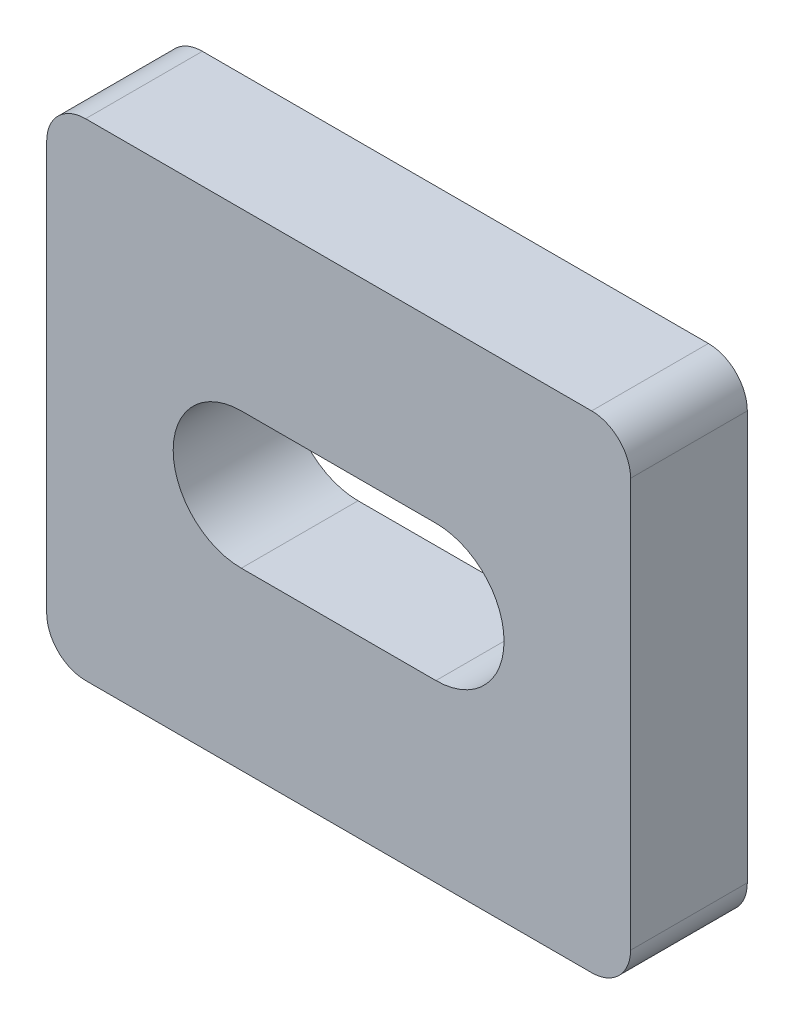
from build123d import *

# Parameters (mm, degrees)
SKETCH_1_W      = 30
SKETCH_1_H      = 25
EXTRUDE_2_DEPTH = 6
FILLET_2_R      = 2


with BuildPart() as part:
    # 스케치1 → 보스-돌출2 (new body)
    with BuildSketch(Plane.XY):
        Rectangle(SKETCH_1_W, SKETCH_1_H)
        with BuildLine():
            ThreePointArc((-5, -3.5), (-8.5, 0), (-5, 3.5))
            Line((-5, 3.5), (5, 3.5))
            ThreePointArc((5, 3.5), (7.474873734, 2.474873734), (8.5, 0))
            ThreePointArc((8.5, 0), (7.474873734, -2.474873734), (5, -3.5))
            Line((5, -3.5), (-5, -3.5))
        make_face(mode=Mode.SUBTRACT)
    extrude(amount=EXTRUDE_2_DEPTH)

    # 필렛2
    fillet_2_edges = [part.edges().sort_by_distance(p)[0] for p in [
        (-15, -12.5, 3),
        (-15, 12.5, 3),
        (15, 12.5, 3),
        (15, -12.5, 3),
    ]]
    fillet(fillet_2_edges, radius=FILLET_2_R)


solid = part.part
